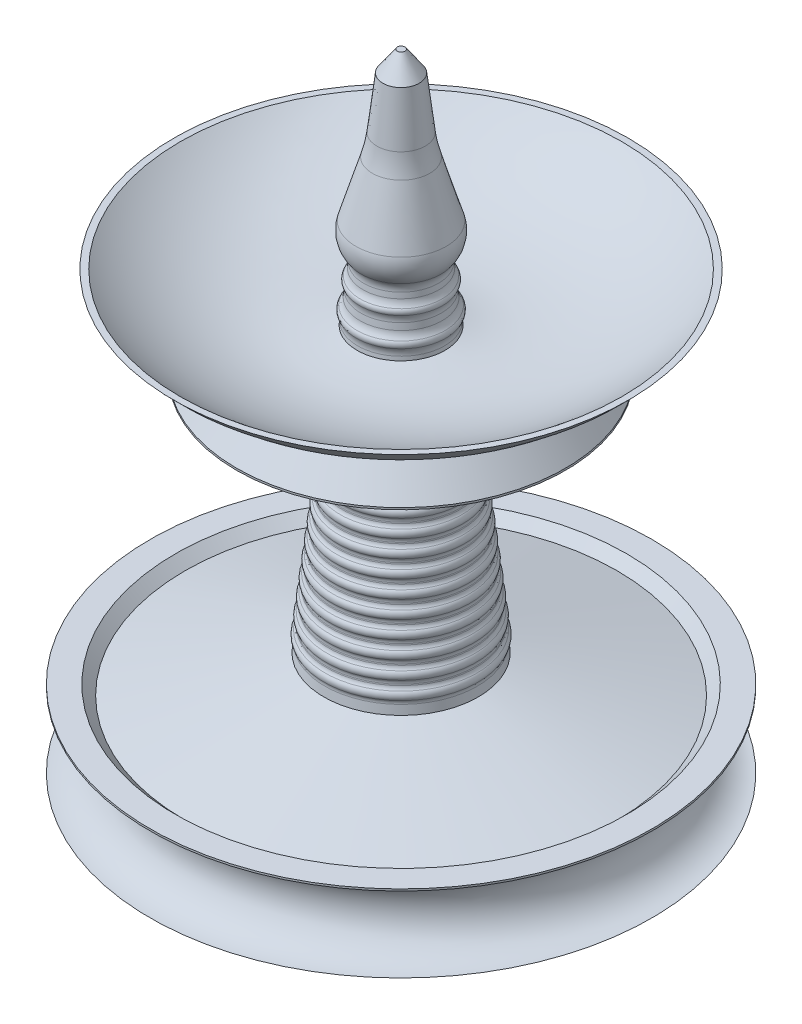
from build123d import *


with BuildPart() as part:
    # Sketch1 → Revolve3 (revolve)
    with BuildSketch(Plane.XY, mode=Mode.PRIVATE) as revolve3_sk:
        with BuildLine():
            Line((0, 0), (0, 500))
            Line((0, 500), (3, 500))
            Line((3, 500), (14.471528727, 483.616959114))
            Line((14.471528727, 483.616959114), (19.291362646, 442.648370803))
            ThreePointArc((19.291362646, 442.648370803), (20.687625006, 434.036954568), (22.829108545, 425.579999653))
            Line((22.829108545, 425.579999653), (35.996027532, 381.719732868))
            ThreePointArc((35.996027532, 381.719732868), (36.558597905, 370.641619324), (31.923742819, 360.563960694))
            ThreePointArc((31.923742819, 360.563960694), (30.132083861, 357.077523576), (29.818200022, 353.170253104))
            Line((29.818200022, 353.170253104), (30.315214989, 348.945625892))
            ThreePointArc((30.315214989, 348.945625892), (31.061107548, 346.161253914), (32.570240359, 343.705322078))
            ThreePointArc((32.570240359, 343.705322078), (33.472250507, 341.609200553), (33.081340512, 339.360970775))
            ThreePointArc((33.081340512, 339.360970775), (32.183390047, 336.621852672), (32.104065525, 333.740396331))
            Line((32.104065525, 333.740396331), (32.693021944, 328.734266766))
            ThreePointArc((32.693021944, 328.734266766), (33.504207647, 325.801489551), (35.159862456, 323.248449873))
            ThreePointArc((35.159862456, 323.248449873), (36.239467286, 320.847599721), (35.746533613, 318.261745039))
            ThreePointArc((35.746533613, 318.261745039), (34.728598724, 315.394165397), (34.620205978, 312.353202482))
            Line((34.620205978, 312.353202482), (34.970513877, 309.375585342))
            ThreePointArc((34.970513877, 309.375585342), (109.983988751, 312.466673771), (176.101071488, 348.035025023))
            Line((176.101071488, 348.035025023), (181.101071488, 348.035025023))
            ThreePointArc((181.101071488, 348.035025023), (147.863737761, 322.166291841), (107.735075475, 309.375585342))
            Line((107.735075475, 309.375585342), (131.073523917, 276.044826719))
            Line((131.073523917, 276.044826719), (131.073523917, 274.544826719))
            Line((131.073523917, 274.544826719), (36.073523917, 300))
            Line((36.073523917, 300), (36.536101671, 296.068089091))
            ThreePointArc((36.536101671, 296.068089091), (36.982239811, 294.513818927), (37.901092603, 293.183215858))
            ThreePointArc((37.901092603, 293.183215858), (39.266083535, 290.298342626), (38.607888873, 287.175447558))
            ThreePointArc((38.607888873, 287.175447558), (38.022933115, 285.667925836), (37.949694212, 284.052552491))
            Line((37.949694212, 284.052552491), (38.055037889, 283.157131235))
            ThreePointArc((38.055037889, 283.157131235), (38.501176029, 281.602861071), (39.420028821, 280.272258002))
            ThreePointArc((39.420028821, 280.272258002), (40.785019753, 277.387384769), (40.126825092, 274.264489702))
            ThreePointArc((40.126825092, 274.264489702), (39.541869334, 272.75696798), (39.46863043, 271.141594635))
            Line((39.46863043, 271.141594635), (39.573974108, 270.246173378))
            ThreePointArc((39.573974108, 270.246173378), (40.020112247, 268.691903215), (40.93896504, 267.361300146))
            ThreePointArc((40.93896504, 267.361300146), (42.303955971, 264.476426913), (41.64576131, 261.353531846))
            ThreePointArc((41.64576131, 261.353531846), (41.060805552, 259.846010124), (40.987566649, 258.230636779))
            Line((40.987566649, 258.230636779), (41.092910326, 257.335215522))
            ThreePointArc((41.092910326, 257.335215522), (41.539048466, 255.780945359), (42.457901258, 254.45034229))
            ThreePointArc((42.457901258, 254.45034229), (43.82289219, 251.565469057), (43.164697528, 248.44257399))
            ThreePointArc((43.164697528, 248.44257399), (42.579741771, 246.935052268), (42.506502867, 245.319678923))
            Line((42.506502867, 245.319678923), (42.611846544, 244.424257666))
            ThreePointArc((42.611846544, 244.424257666), (43.057984684, 242.869987503), (43.976837476, 241.539384433))
            ThreePointArc((43.976837476, 241.539384433), (45.341828408, 238.654511201), (44.683633747, 235.531616134))
            ThreePointArc((44.683633747, 235.531616134), (44.098677989, 234.024094412), (44.025439086, 232.408721067))
            Line((44.025439086, 232.408721067), (44.130782763, 231.51329981))
            ThreePointArc((44.130782763, 231.51329981), (44.576920903, 229.959029646), (45.495773695, 228.628426577))
            ThreePointArc((45.495773695, 228.628426577), (46.860764626, 225.743553345), (46.202569965, 222.620658277))
            ThreePointArc((46.202569965, 222.620658277), (45.617614207, 221.113136555), (45.544375304, 219.49776321))
            Line((45.544375304, 219.49776321), (45.649718981, 218.602341954))
            ThreePointArc((45.649718981, 218.602341954), (46.095857121, 217.04807179), (47.014709913, 215.717468721))
            ThreePointArc((47.014709913, 215.717468721), (48.379700845, 212.832595488), (47.721506184, 209.709700421))
            ThreePointArc((47.721506184, 209.709700421), (47.136550426, 208.202178699), (47.063311522, 206.586805354))
            Line((47.063311522, 206.586805354), (47.1686552, 205.691384097))
            ThreePointArc((47.1686552, 205.691384097), (47.614793339, 204.137113934), (48.533646131, 202.806510865))
            ThreePointArc((48.533646131, 202.806510865), (49.898637063, 199.921637632), (49.240442402, 196.798742565))
            ThreePointArc((49.240442402, 196.798742565), (48.655486644, 195.291220843), (48.582247741, 193.675847498))
            Line((48.582247741, 193.675847498), (48.687591418, 192.780426241))
            ThreePointArc((48.687591418, 192.780426241), (49.133729558, 191.226156078), (50.05258235, 189.895553009))
            ThreePointArc((50.05258235, 189.895553009), (51.417573282, 187.010679776), (50.75937862, 183.887784709))
            ThreePointArc((50.75937862, 183.887784709), (50.174422862, 182.380262987), (50.101183959, 180.764889642))
            Line((50.101183959, 180.764889642), (50.206527636, 179.869468385))
            ThreePointArc((50.206527636, 179.869468385), (50.652665776, 178.315198222), (51.571518568, 176.984595152))
            ThreePointArc((51.571518568, 176.984595152), (52.9365095, 174.09972192), (52.278314839, 170.976826853))
            ThreePointArc((52.278314839, 170.976826853), (51.693359081, 169.469305131), (51.620120177, 167.853931786))
            Line((51.620120177, 167.853931786), (51.725463855, 166.958510529))
            ThreePointArc((51.725463855, 166.958510529), (52.171601994, 165.404240365), (53.090454787, 164.073637296))
            ThreePointArc((53.090454787, 164.073637296), (54.455445718, 161.188764064), (53.797251057, 158.065868996))
            ThreePointArc((53.797251057, 158.065868996), (53.212295299, 156.558347274), (53.139056396, 154.942973929))
            Line((53.139056396, 154.942973929), (53.244400073, 154.047552673))
            ThreePointArc((53.244400073, 154.047552673), (53.690538213, 152.493282509), (54.609391005, 151.16267944))
            ThreePointArc((54.609391005, 151.16267944), (55.974381937, 148.277806207), (55.316187275, 145.15491114))
            ThreePointArc((55.316187275, 145.15491114), (54.731231518, 143.647389418), (54.657992614, 142.032016073))
            Line((54.657992614, 142.032016073), (54.763336291, 141.136594817))
            ThreePointArc((54.763336291, 141.136594817), (55.209474431, 139.582324653), (56.128327223, 138.251721584))
            ThreePointArc((56.128327223, 138.251721584), (57.493318155, 135.366848351), (56.835123494, 132.243953284))
            ThreePointArc((56.835123494, 132.243953284), (56.250167736, 130.736431562), (56.176928833, 129.121058217))
            Line((56.176928833, 129.121058217), (56.28227251, 128.22563696))
            ThreePointArc((56.28227251, 128.22563696), (56.72841065, 126.671366797), (57.647263442, 125.340763728))
            ThreePointArc((57.647263442, 125.340763728), (59.012254373, 122.455890495), (58.354059712, 119.332995428))
            ThreePointArc((58.354059712, 119.332995428), (57.769103954, 117.825473706), (57.695865051, 116.210100361))
            Line((57.695865051, 116.210100361), (57.801208728, 115.314679104))
            ThreePointArc((57.801208728, 115.314679104), (58.247346868, 113.760408941), (59.16619966, 112.429805871))
            ThreePointArc((59.16619966, 112.429805871), (60.531190592, 109.544932639), (59.872995931, 106.422037572))
            ThreePointArc((59.872995931, 106.422037572), (59.288040173, 104.91451585), (59.214801269, 103.299142505))
            Line((59.214801269, 103.299142505), (59.320144947, 102.403721248))
            ThreePointArc((59.320144947, 102.403721248), (59.766283086, 100.849451084), (60.685135878, 99.518848015))
            ThreePointArc((60.685135878, 99.518848015), (62.05012681, 96.633974783), (61.391932149, 93.511079715))
            ThreePointArc((61.391932149, 93.511079715), (60.806976391, 92.003557993), (60.733737488, 90.388184648))
            Line((60.733737488, 90.388184648), (61.558953011, 83.373852697))
            Line((61.558953011, 83.373852697), (172.221825407, 53.721825407))
            Line((172.221825407, 53.721825407), (180, 61.5))
            Line((180, 61.5), (200, 61.5))
            Line((200, 61.5), (200, 60))
            ThreePointArc((200, 60), (170, 30), (200, 0))
            Line((200, 0), (0, 0))
        make_face()
    revolve(revolve3_sk.sketch.rotate(Axis((0, 0, 0), (0, 1, 0)), 90), axis=Axis((0, 0, 0), (0, 1, 0)))


solid = part.part
